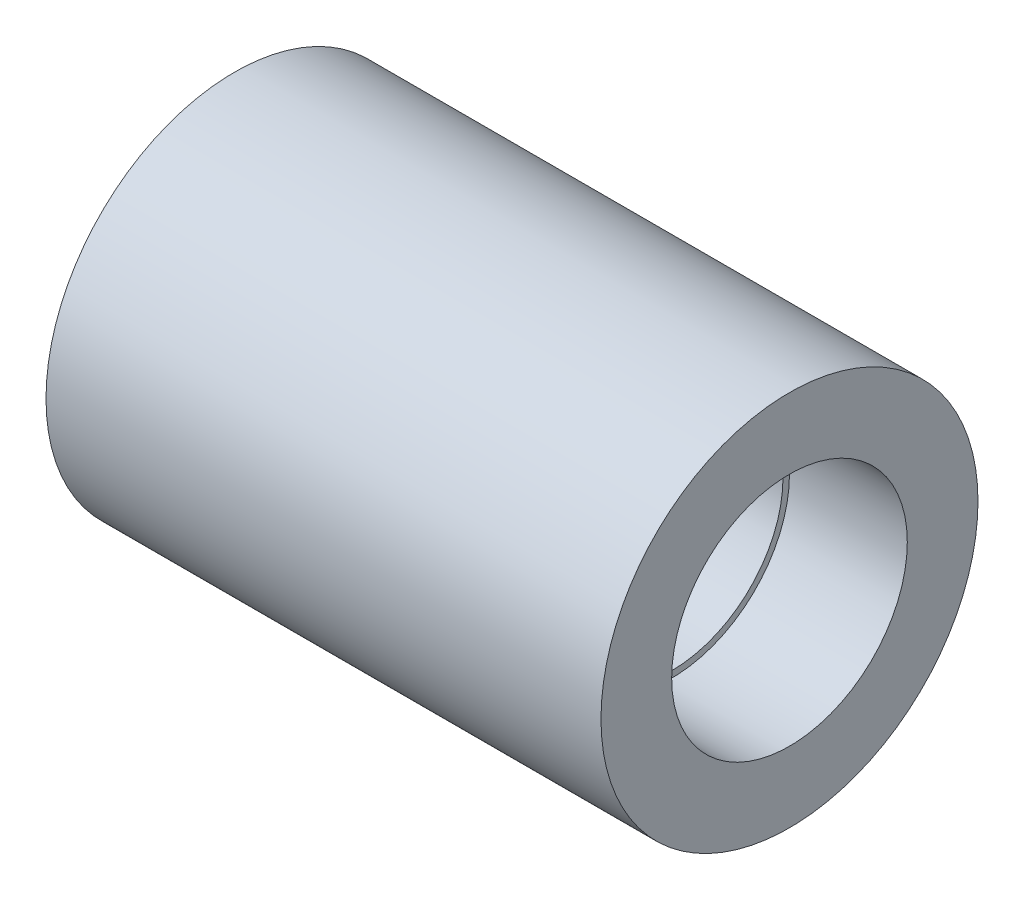
from build123d import *

# Parameters (mm, degrees)
SKETCH1_R           = 5.08
SKETCH1_R_2         = 3.175
BOSS_EXTRUDE1_DEPTH = 3.175
BOSS_EXTRUDE2_START = -11.780000011
SKETCH1_3_R         = 5.08
SKETCH1_3_R_2       = 3
BOSS_EXTRUDE2_DEPTH = 11.780000011


with BuildPart() as part:
    # Sketch1 → Boss-Extrude1 (new body)
    with BuildSketch(Plane(origin=(0, 0, 0), x_dir=(0, 0, -1), z_dir=(1, 0, 0))):
        Circle(SKETCH1_R)
        Circle(SKETCH1_R_2, mode=Mode.SUBTRACT)
    extrude(amount=BOSS_EXTRUDE1_DEPTH)

    # Sketch1<3> → Boss-Extrude2 (add)
    with BuildSketch(Plane(origin=(0, 0, 0), x_dir=(0, 0, -1), z_dir=(1, 0, 0)).offset(BOSS_EXTRUDE2_START)):
        Circle(SKETCH1_3_R)
        Circle(SKETCH1_3_R_2, mode=Mode.SUBTRACT)
    extrude(amount=BOSS_EXTRUDE2_DEPTH)


solid = part.part
